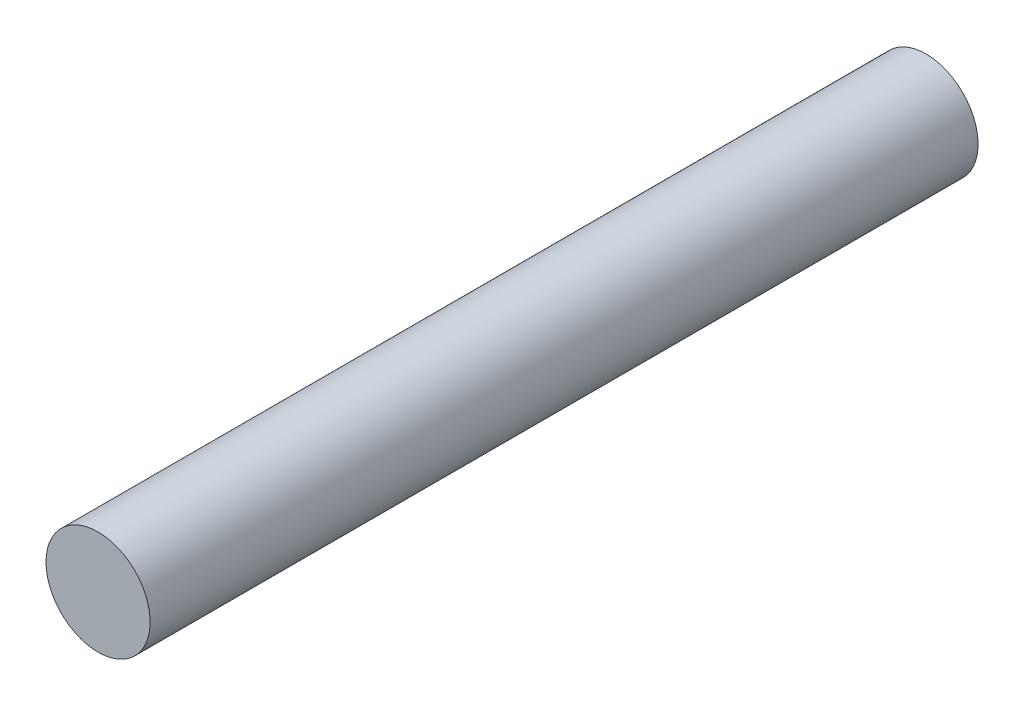
from build123d import *

# Parameters (mm, degrees)
SKETCH1_R           = 10
BOSS_EXTRUDE1_DEPTH = 159


with BuildPart() as part:
    # Sketch1 → Boss-Extrude1 (new body)
    with BuildSketch(Plane.XY):
        with Locations(Location((0, 0, 0), (0, 0, 180))):
            Circle(SKETCH1_R)
    extrude(amount=BOSS_EXTRUDE1_DEPTH)


solid = part.part
